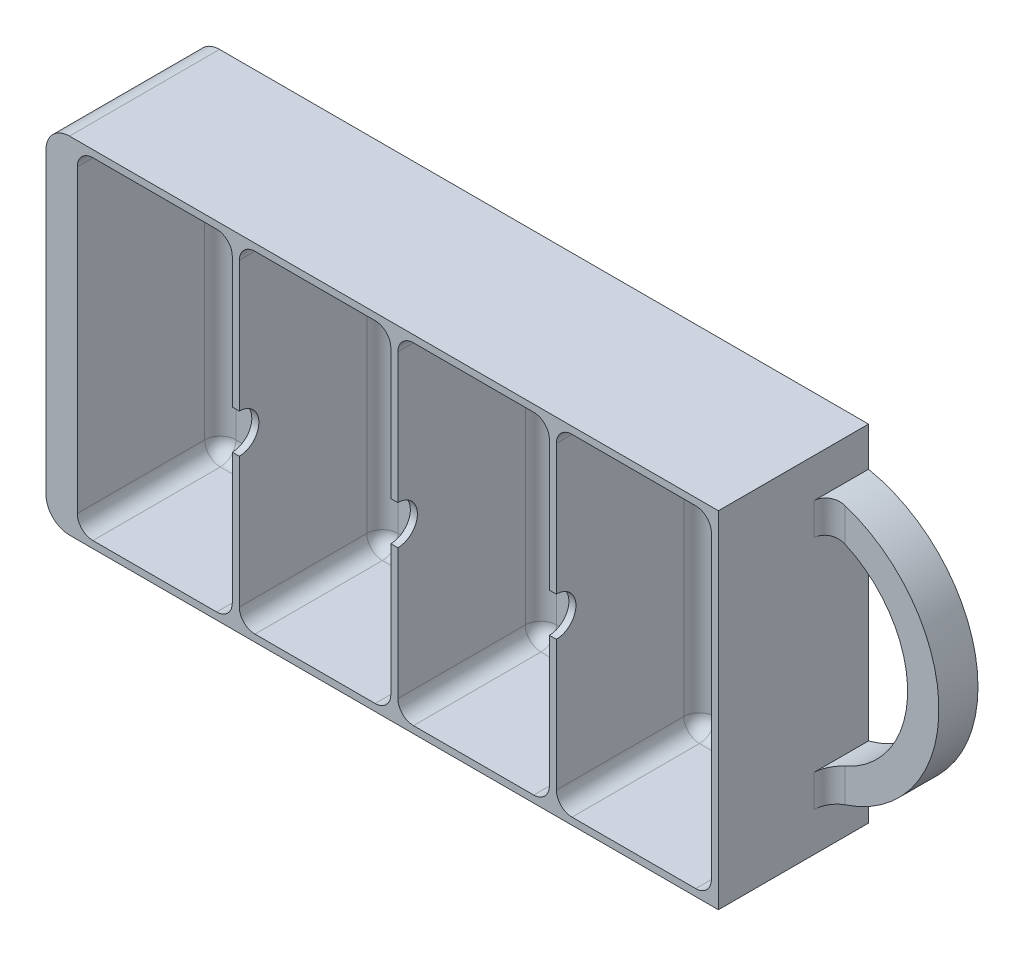
from build123d import *

# Parameters (mm, degrees)
SKETCH_1_W                  = 86
SKETCH_1_H                  = 44.2
EXTRUDE_1_DEPTH             = 14.2
EXTRUDE_2_DEPTH             = 5
SKETCH_3_W                  = 19.825
SKETCH_3_H                  = 42.4
CUT_EXTRUDE_1_DEPTH         = 18.3
SKETCH_4_W                  = 19.375
SKETCH_4_H                  = 42.4
CUT_EXTRUDE_2_DEPTH         = 18.3
SKETCH_5_W                  = 19.375
SKETCH_5_H                  = 42.4
CUT_EXTRUDE_3_DEPTH         = 18.3
SKETCH_6_W                  = 19.825
SKETCH_6_H                  = 42.4
CUT_EXTRUDE_4_DEPTH         = 18.3
HOLE_WIZARD_8_3_8_3_1_D     = 8.3
HOLE_WIZARD_8_3_8_3_1_DEPTH = 3.2
HOLE_WIZARD_5_0_5_1_D       = 5
HOLE_WIZARD_5_0_5_1_DEPTH   = 0.9
HOLE_WIZARD_5_0_5_2_D       = 5
HOLE_WIZARD_5_0_5_2_DEPTH   = 0.9
HOLE_WIZARD_5_0_5_3_D       = 5
HOLE_WIZARD_5_0_5_3_DEPTH   = 0.9
FILLET_1_R                  = 3
EXTRUDE_START               = -3.5
SKETCH_15_R                 = 4.15
EXTRUDE_3_DEPTH             = 3.5
FILLET_3_R                  = 2


with BuildPart() as part:
    # Эскиз1 → Бобышка-Вытянуть1 (new body)
    with BuildSketch(Plane.XY.offset(9.6)):
        with Locations((47, 0)):
            Rectangle(SKETCH_1_W, SKETCH_1_H)
    extrude(amount=-EXTRUDE_1_DEPTH)

    # Эскиз2 → Бобышка-Вытянуть2 (add)
    with BuildSketch(Plane(origin=(0, 0, -4.6), x_dir=(-1, 0, 0), z_dir=(0, 0, -1))):
        with BuildLine():
            Line((-90, -22.1), (-90, -17.1))
            ThreePointArc((-90, -17.1), (-104, 0), (-90, 17.1))
            Line((-90, 17.1), (-90, 22.1))
            Line((-90, 22.1), (-4, 22.1))
            Line((-4, 22.1), (-4, -22.1))
            Line((-4, -22.1), (-90, -22.1))
        make_face()
        with BuildLine():
            Line((-90, -12.994779171), (-90, 12.994779171))
            ThreePointArc((-90, 12.994779171), (-100, 0), (-90, -12.994779171))
        make_face(mode=Mode.SUBTRACT)
    extrude(amount=EXTRUDE_2_DEPTH)

    # Эскиз3 → Вырез-Вытянуть1 (cut)
    with BuildSketch(Plane.XY.offset(9.6)):
        with Locations((79.1875, 0)):
            Rectangle(SKETCH_3_W, SKETCH_3_H)
    extrude(amount=-CUT_EXTRUDE_1_DEPTH, mode=Mode.SUBTRACT)

    # Эскиз4 → Вырез-Вытянуть2 (cut)
    with BuildSketch(Plane.XY.offset(9.6)):
        with Locations((58.6875, 0)):
            Rectangle(SKETCH_4_W, SKETCH_4_H)
    extrude(amount=-CUT_EXTRUDE_2_DEPTH, mode=Mode.SUBTRACT)

    # Эскиз5 → Вырез-Вытянуть3 (cut)
    with BuildSketch(Plane.XY.offset(9.6)):
        with Locations((38.4125, 0)):
            Rectangle(SKETCH_5_W, SKETCH_5_H)
    extrude(amount=-CUT_EXTRUDE_3_DEPTH, mode=Mode.SUBTRACT)

    # Эскиз6 → Вырез-Вытянуть4 (cut)
    with BuildSketch(Plane.XY.offset(9.6)):
        with Locations((17.9125, 0)):
            Rectangle(SKETCH_6_W, SKETCH_6_H)
    extrude(amount=-CUT_EXTRUDE_4_DEPTH, mode=Mode.SUBTRACT)

    # Диаметр отверстия Ø8.3 (8.3)1
    with Locations(Plane.ZY.offset(-4)):
        with Locations((0, 0)):
            Hole(HOLE_WIZARD_8_3_8_3_1_D / 2, depth=HOLE_WIZARD_8_3_8_3_1_DEPTH)

    # Диаметр отверстия Ø5.0 (5)1
    with Locations(Plane(origin=(28.725, 0, 0), x_dir=(0, 0, -1), z_dir=(1, 0, 0))):
        with Locations((-9.6, 0)):
            Hole(HOLE_WIZARD_5_0_5_1_D / 2, depth=HOLE_WIZARD_5_0_5_1_DEPTH)

    # Диаметр отверстия Ø5.0 (5)2
    with Locations(Plane.ZY.offset(-48.1)):
        with Locations((9.6, 0)):
            Hole(HOLE_WIZARD_5_0_5_2_D / 2, depth=HOLE_WIZARD_5_0_5_2_DEPTH)

    # Диаметр отверстия Ø5.0 (5)3
    with Locations(Plane.ZY.offset(-68.375)):
        with Locations((9.6, 0)):
            Hole(HOLE_WIZARD_5_0_5_3_D / 2, depth=HOLE_WIZARD_5_0_5_3_DEPTH)

    # Скругление1
    fillet_1_edges = [part.edges().sort_by_distance(p)[0] for p in [
        (4, -22.1, 0),
        (4, 22.1, 0),
    ]]
    fillet(fillet_1_edges, radius=FILLET_1_R)

    # Эскиз15 → Бобышка-Вытянуть3 (add)
    with BuildSketch(Plane.ZY.offset(-4).offset(EXTRUDE_START)):
        Circle(SKETCH_15_R)
    extrude(amount=EXTRUDE_3_DEPTH)

    # Скругление3
    fillet_3_edges = [part.edges().sort_by_distance(p)[0] for p in [
        (90, -15.047389586, -4.6),
        (90, 15.047389586, -4.6),
        (79.1875, 21.2, -8.7),
        (69.275, 21.2, 0.45),
        (89.1, 0, -8.7),
        (89.1, 21.2, 0.45),
        (79.1875, -21.2, -8.7),
        (89.1, -21.2, 0.45),
        (69.275, 0, -8.7),
        (69.275, -21.2, 0.45),
        (49, 0, -8.7),
        (49, -21.2, 0.45),
        (58.6875, 21.2, -8.7),
        (49, 21.2, 0.45),
        (68.375, 0, -8.7),
        (68.375, 21.2, 0.45),
        (58.6875, -21.2, -8.7),
        (68.375, -21.2, 0.45),
        (28.725, 0, -8.7),
        (28.725, -21.2, 0.45),
        (38.4125, 21.2, -8.7),
        (28.725, 21.2, 0.45),
        (48.1, 0, -8.7),
        (48.1, 21.2, 0.45),
        (38.4125, -21.2, -8.7),
        (48.1, -21.2, 0.45),
        (17.9125, -21.2, -8.7),
        (27.825, -21.2, 0.45),
        (8, 0, -8.7),
        (8, -21.2, 0.45),
        (17.9125, 21.2, -8.7),
        (8, 21.2, 0.45),
        (27.825, 0, -8.7),
        (27.825, 21.2, 0.45),
    ]]
    fillet(fillet_3_edges, radius=FILLET_3_R)


solid = part.part
